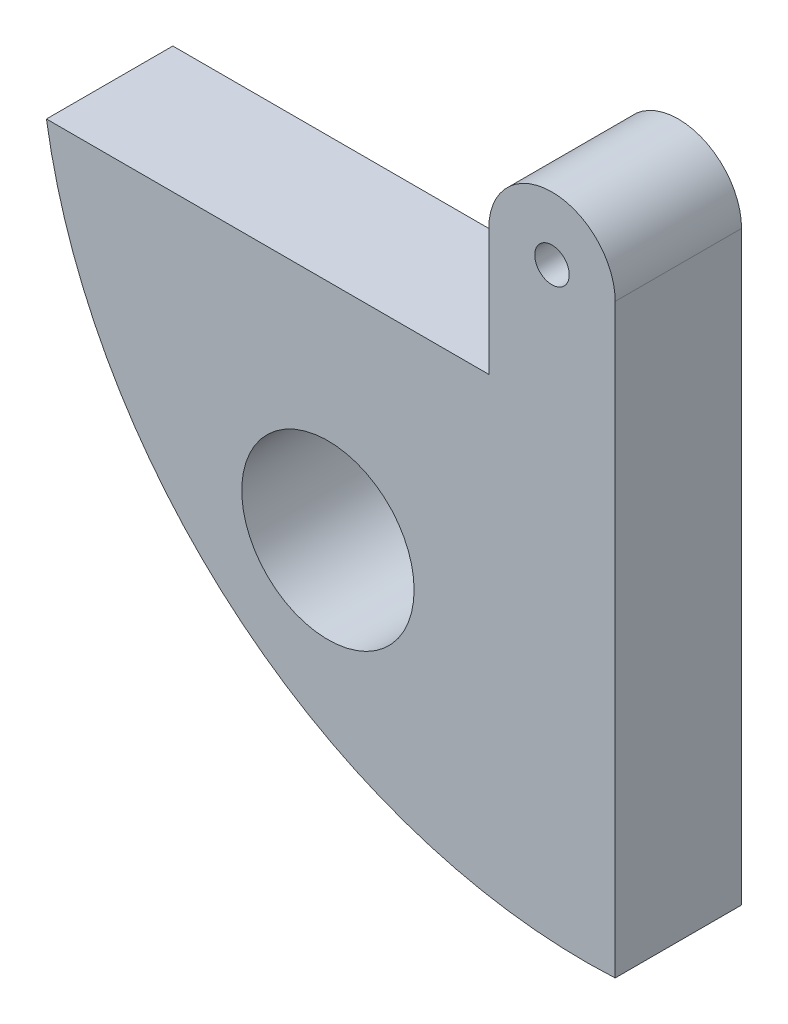
from build123d import *

# Parameters (mm, degrees)
ESQUISSE1_R        = 15
ESQUISSE1_R_2      = 3
BOSS_EXTRU_3_DEPTH = 22


with BuildPart() as part:
    # Esquisse1 → Boss.-Extru.3 (new body)
    with BuildSketch(Plane.XY):
        with BuildLine():
            Line((0, 0), (0, 61))
            ThreePointArc((0, 61), (-11, 72), (-22, 61))
            Line((-22, 61), (-22, 39))
            Line((-22, 39), (-99, 39))
            ThreePointArc((-99, 39), (-64.878684474, -20.031122037), (0, -41))
            Line((0, -41), (0, 0))
        make_face()
        with Locations((-50, 0)):
            Circle(ESQUISSE1_R, mode=Mode.SUBTRACT)
        with Locations((-11, 61)):
            Circle(ESQUISSE1_R_2, mode=Mode.SUBTRACT)
    extrude(amount=BOSS_EXTRU_3_DEPTH)


solid = part.part
